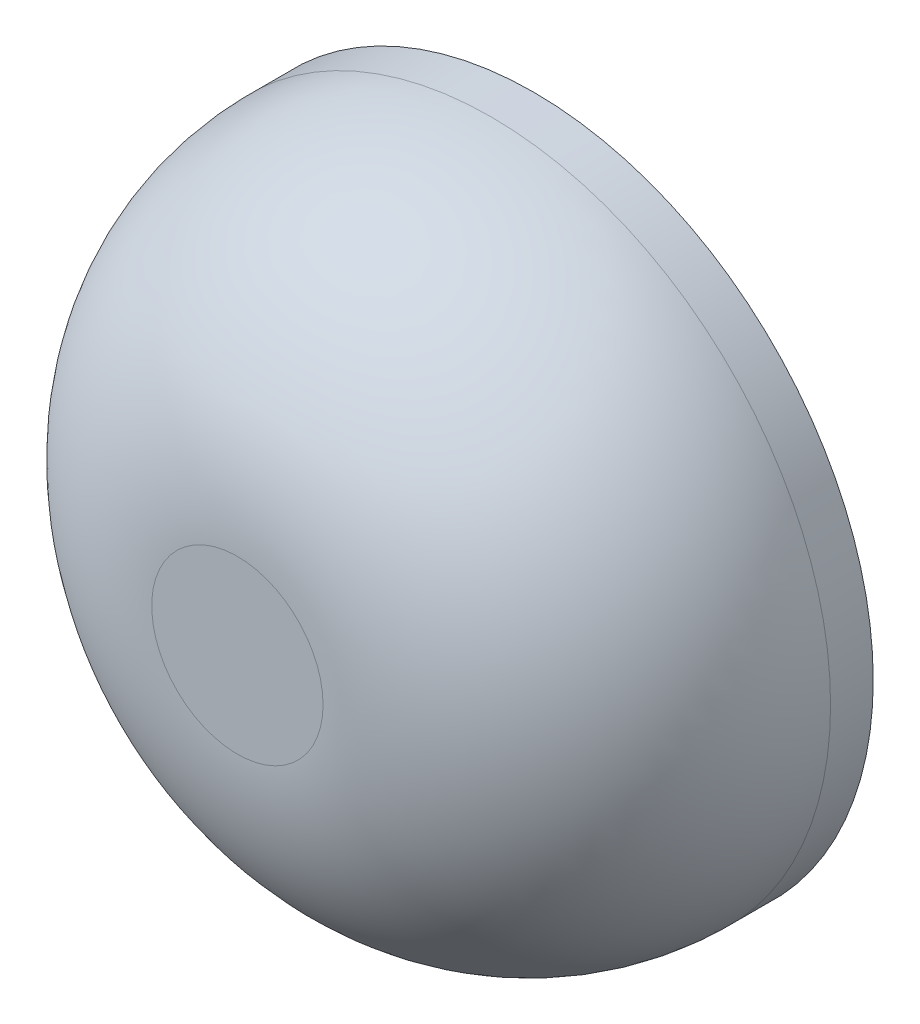
from build123d import *

# Parameters (mm, degrees)
SKETCH1_R           = 69.85
BOSS_EXTRUDE1_DEPTH = 61
FILLET1_R           = 52.22


with BuildPart() as part:
    # Sketch1 → Boss-Extrude1 (new body)
    with BuildSketch(Plane.XY):
        with Locations(Location((0, 0, 0), (0, 0, 180))):
            Circle(SKETCH1_R)
    extrude(amount=BOSS_EXTRUDE1_DEPTH)

    # Fillet1
    fillet1_edges = [part.edges().sort_by_distance(p)[0] for p in [
        (69.85, 0, 61),
    ]]
    fillet(fillet1_edges, radius=FILLET1_R)


solid = part.part
